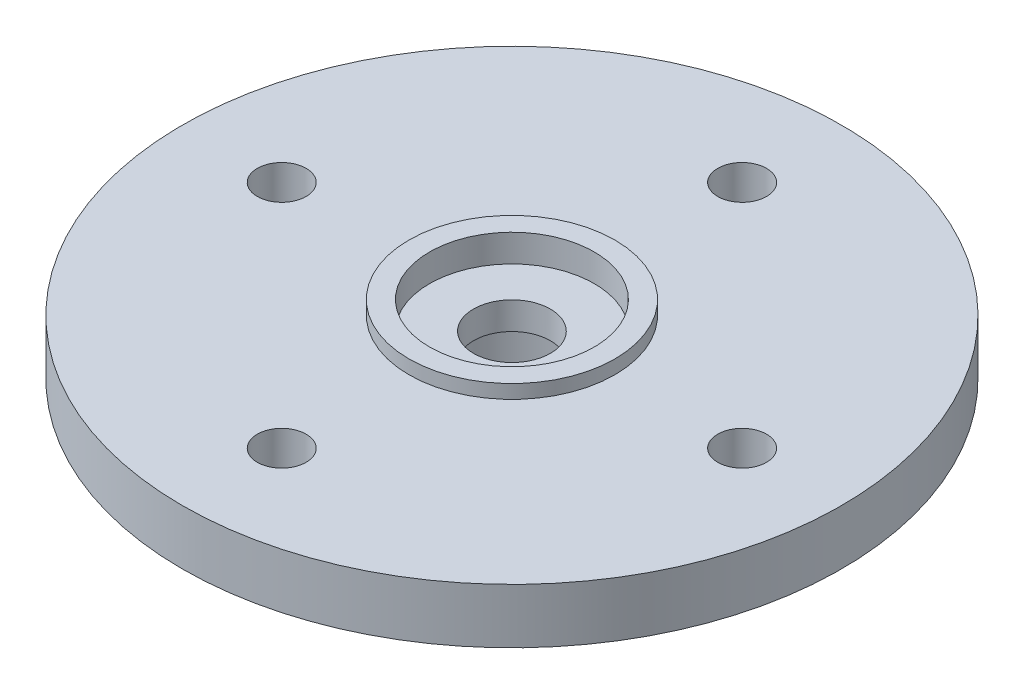
from build123d import *

# Parameters (mm, degrees)
F_2_56_TAPPED_HOLE1_D = 1.778
SKETCH4_R             = 3
CUT_EXTRUDE1_DEPTH    = 1
CUT_EXTRUDE2_START    = -3
SKETCH5_R             = 3
CUT_EXTRUDE2_DEPTH    = 3


with BuildPart() as part:
    # Sketch1 → Revolve1 (revolve)
    with BuildSketch(Plane.XY, mode=Mode.PRIVATE) as revolve1_sk:
        Polygon((-12, 0), (-3.75, 0), (-3.75, 0.5), (-1.4, 0.5), (-1.4, -4.5), (-4.5, -4.5), (-4.5, -2), (-12, -2), align=None)
    revolve(revolve1_sk.sketch.rotate(Axis((0, 0, 0), (0, -1, 0)), 270), axis=Axis((0, 0, 0), (0, -1, 0)))

    # #2-56 Tapped Hole1 (through all)
    with Locations(Plane(origin=(0, 0, 0), x_dir=(-1, 0, 0), z_dir=(0, 1, 0))):
        with Locations((0, -8.382), (8.382, 0), (-8.382, 0), (0, 8.382)):
            Hole(F_2_56_TAPPED_HOLE1_D / 2)

    # Sketch4 → Cut-Extrude1 (cut)
    with BuildSketch(Plane(origin=(0, 0.5, 0), x_dir=(-1, 0, 0), z_dir=(0, 1, 0))):
        with Locations(Location((0, 0, 0), (0, 0, 90))):
            Circle(SKETCH4_R)
    extrude(amount=-CUT_EXTRUDE1_DEPTH, mode=Mode.SUBTRACT)

    # Sketch5 → Cut-Extrude2 (cut)
    with BuildSketch(Plane.XZ.offset(4.5).offset(CUT_EXTRUDE2_START)):
        with Locations(Location((0, 0, 0), (0, 0, 90))):
            Circle(SKETCH5_R)
    extrude(amount=CUT_EXTRUDE2_DEPTH, mode=Mode.SUBTRACT)


solid = part.part
